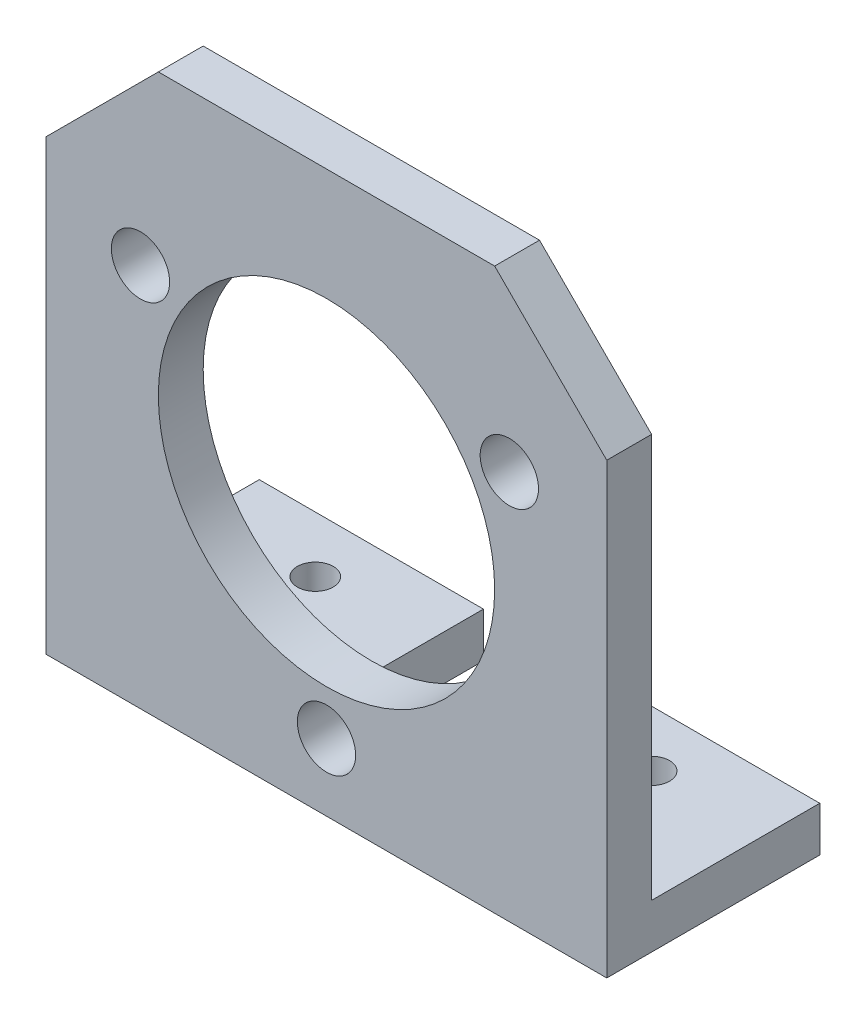
from build123d import *

# Parameters (mm, degrees)
SKETCH_1_R          = 2.6
SKETCH_1_R_2        = 15
SKETCH_1_W          = 20
SKETCH_1_H          = 4
EXTRUDE_1_DEPTH     = 4
SKETCH_3_W          = 20
SKETCH_3_H          = 4
EXTRUDE_2_DEPTH     = 15
SKETCH_4_R          = 1.6
CUT_EXTRUDE_1_DEPTH = 15


with BuildPart() as part:
    # 草图1 → 凸台-拉伸1 (new body)
    # profile 1 of 3: a face of its own
    with BuildSketch(Plane.XY):
        Polygon((-25, 15), (-25, 0), (-25, -21), (-5, -21), (-5, -25), (5, -25), (5, -21), (25, -21), (25, 0), (25, 15), (15, 25), (0, 25), (-15, 25), align=None)
        with Locations((0, -19)):
            Circle(SKETCH_1_R, mode=Mode.SUBTRACT)
        Circle(SKETCH_1_R_2, mode=Mode.SUBTRACT)
        with Locations((-16.592996047, 9.255943073)):
            Circle(SKETCH_1_R, mode=Mode.SUBTRACT)
        with Locations((16.309882981, 9.746164228)):
            Circle(SKETCH_1_R, mode=Mode.SUBTRACT)
    # profile 2 of 3: a face of its own
    with BuildSketch(Plane.XY):
        with Locations((15, -23)):
            Rectangle(SKETCH_1_W, SKETCH_1_H)
    # profile 3 of 3: a face of its own
    with BuildSketch(Plane.XY):
        with Locations((-15, -23)):
            Rectangle(SKETCH_1_W, SKETCH_1_H)
    extrude(amount=EXTRUDE_1_DEPTH)

    # 草图3 → 凸台-拉伸2 (add)
    with BuildSketch(Plane(origin=(0, 0, 0), x_dir=(-1, 0, 0), z_dir=(0, 0, -1))):
        with Locations((-15, -23)):
            Rectangle(SKETCH_3_W, SKETCH_3_H)
        with Locations((15, -23)):
            Rectangle(SKETCH_3_W, SKETCH_3_H)
    extrude(amount=EXTRUDE_2_DEPTH)

    # 草图4 → 切除-拉伸1 (cut)
    with BuildSketch(Plane.XZ.offset(25)):
        with Locations(Location((-15, -10, 0), (0, 0, 270))):
            Circle(SKETCH_4_R)
        with Locations(Location((15, -10, 0), (0, 0, 270))):
            Circle(SKETCH_4_R)
    extrude(amount=-CUT_EXTRUDE_1_DEPTH, mode=Mode.SUBTRACT)


solid = part.part
